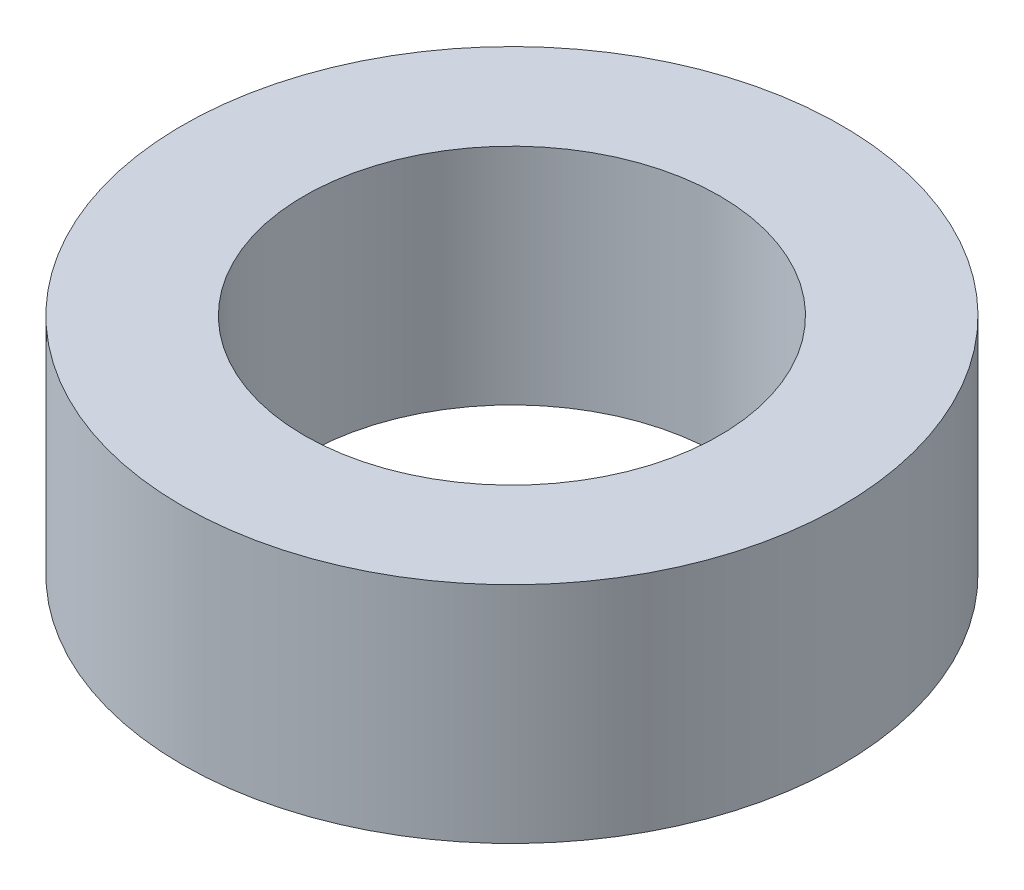
from build123d import *

# Parameters (mm, degrees)
SKETCH1_R           = 6.35
BOSS_EXTRUDE1_DEPTH = 4.318
SKETCH3_R           = 4
CUT_EXTRUDE2_DEPTH  = 10.964442985


with BuildPart() as part:
    # Sketch1 → Boss-Extrude1 (new body)
    with BuildSketch(Plane(origin=(0, 0, 0), x_dir=(1, 0, 0), z_dir=(0, 1, 0))):
        with Locations(Location((0, 0, 0), (0, 0, 270))):
            Circle(SKETCH1_R)
    extrude(amount=BOSS_EXTRUDE1_DEPTH)

    # Sketch3 → Cut-Extrude2 (cut, through all)
    with BuildSketch(Plane(origin=(0, 4.318, 0), x_dir=(1, 0, 0), z_dir=(0, 1, 0))):
        with Locations(Location((0, 0, 0), (0, 0, 270))):
            Circle(SKETCH3_R)
    extrude(amount=-CUT_EXTRUDE2_DEPTH, mode=Mode.SUBTRACT)


solid = part.part
